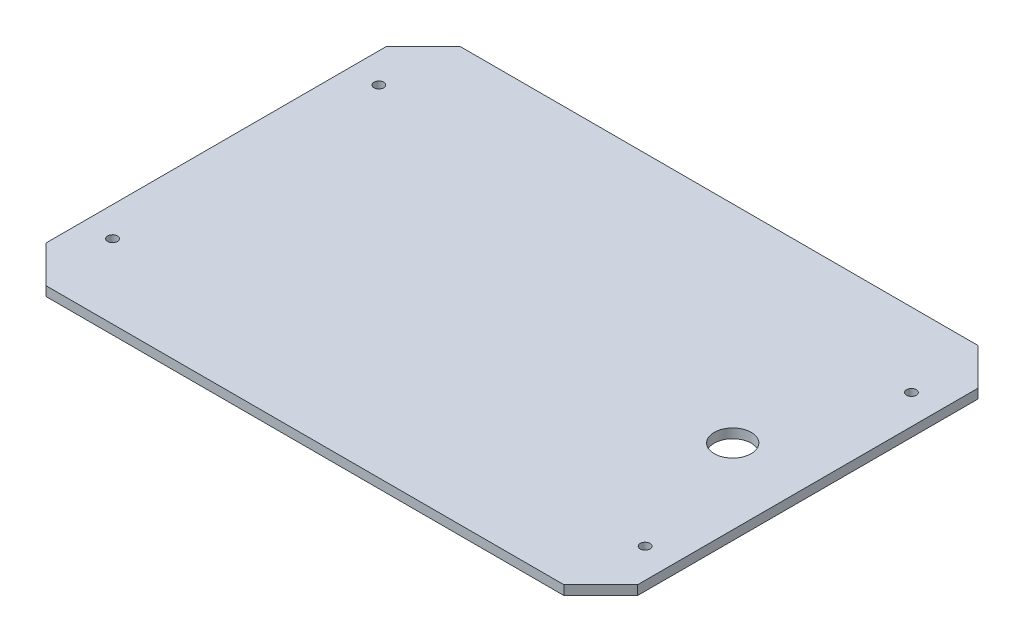
from build123d import *

# Parameters (mm, degrees)
SKETCH1_W            = 400
SKETCH1_H            = 280
BOSS_EXTRUDE1_DEPTH  = 6.35
CHAMFER1_SIZE        = 25
SKETCH2_R            = 12.5
CUT_EXTRUDE1_DEPTH   = 489.303514732
M6_CLEARANCE_HOLE1_D = 6.6


with BuildPart() as part:
    # Sketch1 → Boss-Extrude1 (new body)
    with BuildSketch(Plane(origin=(0, 0, 0), x_dir=(1, 0, 0), z_dir=(0, 1, 0))):
        with Locations((200, 140)):
            Rectangle(SKETCH1_W, SKETCH1_H)
    extrude(amount=BOSS_EXTRUDE1_DEPTH)

    # Chamfer1
    chamfer1_edges = [part.edges().sort_by_distance(p)[0] for p in [
        (0, 3.175, -280),
        (400, 3.175, -280),
        (400, 3.175, 0),
        (0, 3.175, 0),
    ]]
    chamfer(chamfer1_edges, length=CHAMFER1_SIZE)

    # Sketch2 → Cut-Extrude1 (cut, through all)
    with BuildSketch(Plane(origin=(0, 6.35, 0), x_dir=(1, 0, 0), z_dir=(0, 1, 0))):
        with Locations(Location((349.2, 140, 0), (0, 0, 270))):
            Circle(SKETCH2_R)
    extrude(amount=-CUT_EXTRUDE1_DEPTH, mode=Mode.SUBTRACT)

    # M6 Clearance Hole1 (through all)
    with Locations(Plane(origin=(0, 6.35, 0), x_dir=(1, 0, 0), z_dir=(0, 1, 0))):
        with Locations((380, 230), (380, 50), (20, 50), (20, 230)):
            Hole(M6_CLEARANCE_HOLE1_D / 2)


solid = part.part
